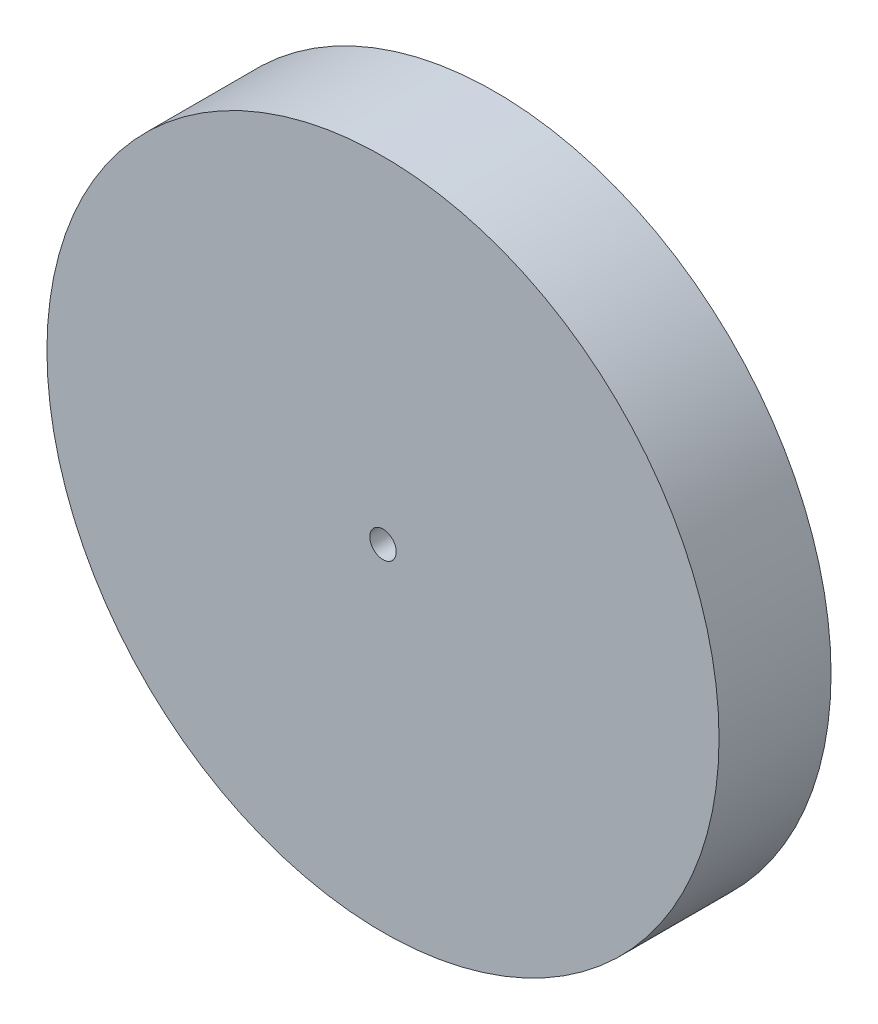
from build123d import *

# Parameters (mm, degrees)
SKETCH1_R           = 76.2
SKETCH1_R_2         = 3
BOSS_EXTRUDE1_DEPTH = 25.4


with BuildPart() as part:
    # Sketch1 → Boss-Extrude1 (new body)
    with BuildSketch(Plane.XY):
        Circle(SKETCH1_R)
        Circle(SKETCH1_R_2, mode=Mode.SUBTRACT)
    extrude(amount=BOSS_EXTRUDE1_DEPTH)


solid = part.part
